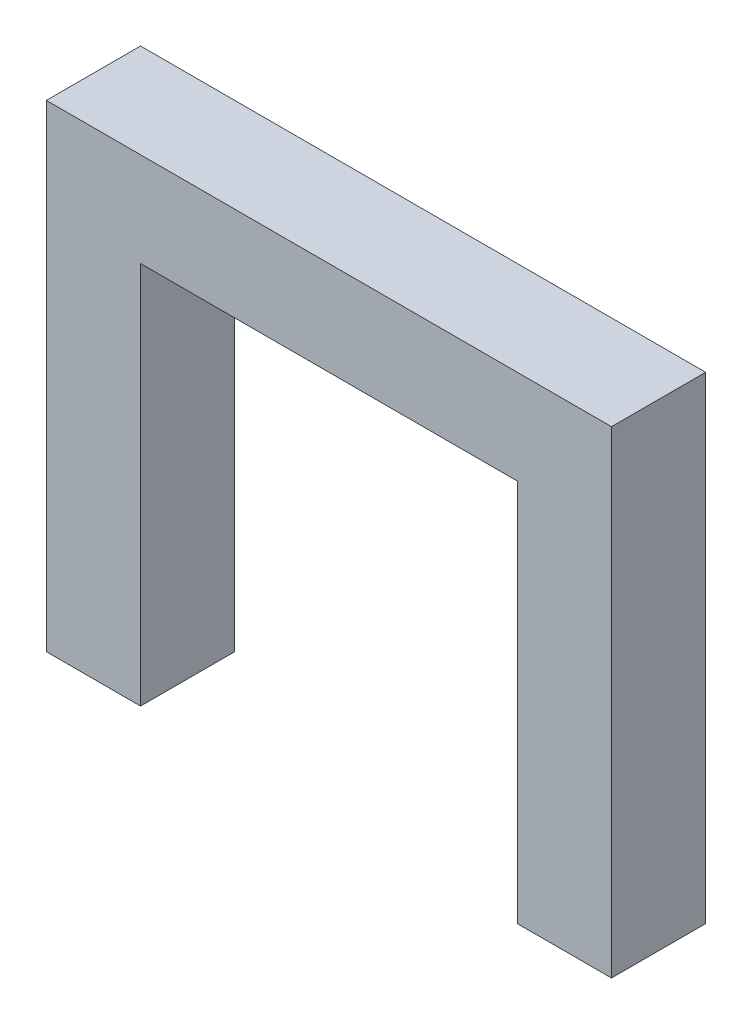
from build123d import *

# Parameters (mm, degrees)
SKETCH1_W           = 20
SKETCH1_H           = 81.38
BOSS_EXTRUDE2_DEPTH = 20


with BuildPart() as part:
    # Sketch1 → Boss-Extrude2 (new body)
    with BuildSketch(Plane.XY):
        with Locations((-18.451882845, -12.070753138)):
            Rectangle(SKETCH1_W, SKETCH1_H)
        Polygon((-28.451882845, 48.619246862), (-28.451882845, 28.619246862), (-8.451882845, 28.619246862), (71.548117155, 28.619246862), (91.548117155, 28.619246862), (91.548117155, 48.619246862), align=None)
        with Locations((81.548117155, -12.070753138)):
            Rectangle(SKETCH1_W, SKETCH1_H)
    extrude(amount=BOSS_EXTRUDE2_DEPTH)


solid = part.part
